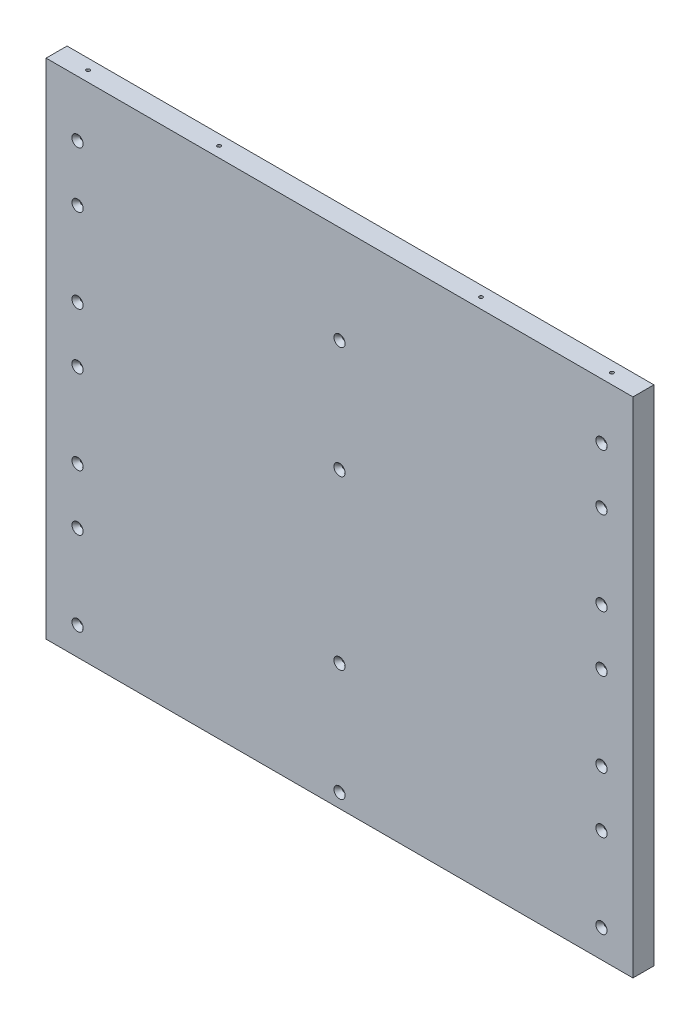
from build123d import *

# Parameters (mm, degrees)
SKETCH1_W           = 533.146
SKETCH1_H           = 457.2
BOSS_EXTRUDE1_DEPTH = 19.05
HOLE1_D             = 3.175
HOLE1_DEPTH         = 50.8
HOLE1_CSINK_D       = 10.16
HOLE1_CSINK_ANGLE   = 82
HOLE1_TIP           = 0.953866233
HOLE2_D             = 3.175
HOLE2_DEPTH         = 38.1
HOLE2_CSINK_D       = 10.16
HOLE2_CSINK_ANGLE   = 82
HOLE2_TIP           = 0.953866233
HOLE3_D             = 3.175
HOLE3_DEPTH         = 38.1
HOLE3_CSINK_D       = 10.16
HOLE3_CSINK_ANGLE   = 82
HOLE3_TIP           = 0.953866233


with BuildPart() as part:
    # Sketch1 → Boss-Extrude1 (new body)
    with BuildSketch(Plane.XY):
        with Locations((0, 2912.11)):
            Rectangle(SKETCH1_W, SKETCH1_H)
    extrude(amount=-BOSS_EXTRUDE1_DEPTH)

    # Hole1
    with Locations(Plane.XY):
        with Locations((0, 2696.21), (-237.998, 3089.91), (-237.998, 3039.11), (-237.998, 2962.91), (-237.998, 2912.11), (-237.998, 2835.91), (-237.998, 2785.11), (-237.998, 2708.91), (237.998, 2708.91), (237.998, 2785.11), (237.998, 2835.91), (237.998, 2912.11), (237.998, 2962.91), (237.998, 3039.11), (237.998, 3089.91), (0, 3051.81), (0, 2950.21), (0, 2797.81)):
            CounterSinkHole(HOLE1_D / 2, HOLE1_CSINK_D / 2, depth=HOLE1_DEPTH, counter_sink_angle=HOLE1_CSINK_ANGLE)
            with Locations((0, 0, -(HOLE1_DEPTH + HOLE1_TIP / 2))):  # 118° drill point
                Cone(0, HOLE1_D / 2, HOLE1_TIP, mode=Mode.SUBTRACT)

    # Hole2
    with Locations(Plane(origin=(0, 3159.76, -7002.779994921), x_dir=(-1, 0, 0), z_dir=(0, 1, 0))):
        with Locations((-118.999, 6993.254994921), (237.998, 6993.254994921), (237.998, 6958.329994921), (237.998, 6845.512682081), (-237.998, 6993.254994921), (-237.998, 6958.329994921), (-237.998, 6845.512682081), (118.999, 6993.254994921)):
            CounterSinkHole(HOLE2_D / 2, HOLE2_CSINK_D / 2, depth=HOLE2_DEPTH, counter_sink_angle=HOLE2_CSINK_ANGLE)
            with Locations((0, 0, -(HOLE2_DEPTH + HOLE2_TIP / 2))):  # 118° drill point
                Cone(0, HOLE2_D / 2, HOLE2_TIP, mode=Mode.SUBTRACT)

    # Hole3
    with Locations(Plane(origin=(0, 2664.46, -7002.779994921), x_dir=(1, 0, 0), z_dir=(0, -1, 0))):
        with Locations((-237.998, 6686.191891629), (237.998, 6686.191891629), (257.048, 6993.254994921), (218.948, 6993.254994921), (19.05, 6993.254994921), (237.998, 6939.279994921), (237.998, 6812.735943275), (-237.998, 6812.735943275), (-237.998, 6939.279994921), (-19.05, 6993.254994921), (-218.948, 6993.254994921), (-257.048, 6993.254994921)):
            CounterSinkHole(HOLE3_D / 2, HOLE3_CSINK_D / 2, depth=HOLE3_DEPTH, counter_sink_angle=HOLE3_CSINK_ANGLE)
            with Locations((0, 0, -(HOLE3_DEPTH + HOLE3_TIP / 2))):  # 118° drill point
                Cone(0, HOLE3_D / 2, HOLE3_TIP, mode=Mode.SUBTRACT)


solid = part.part
